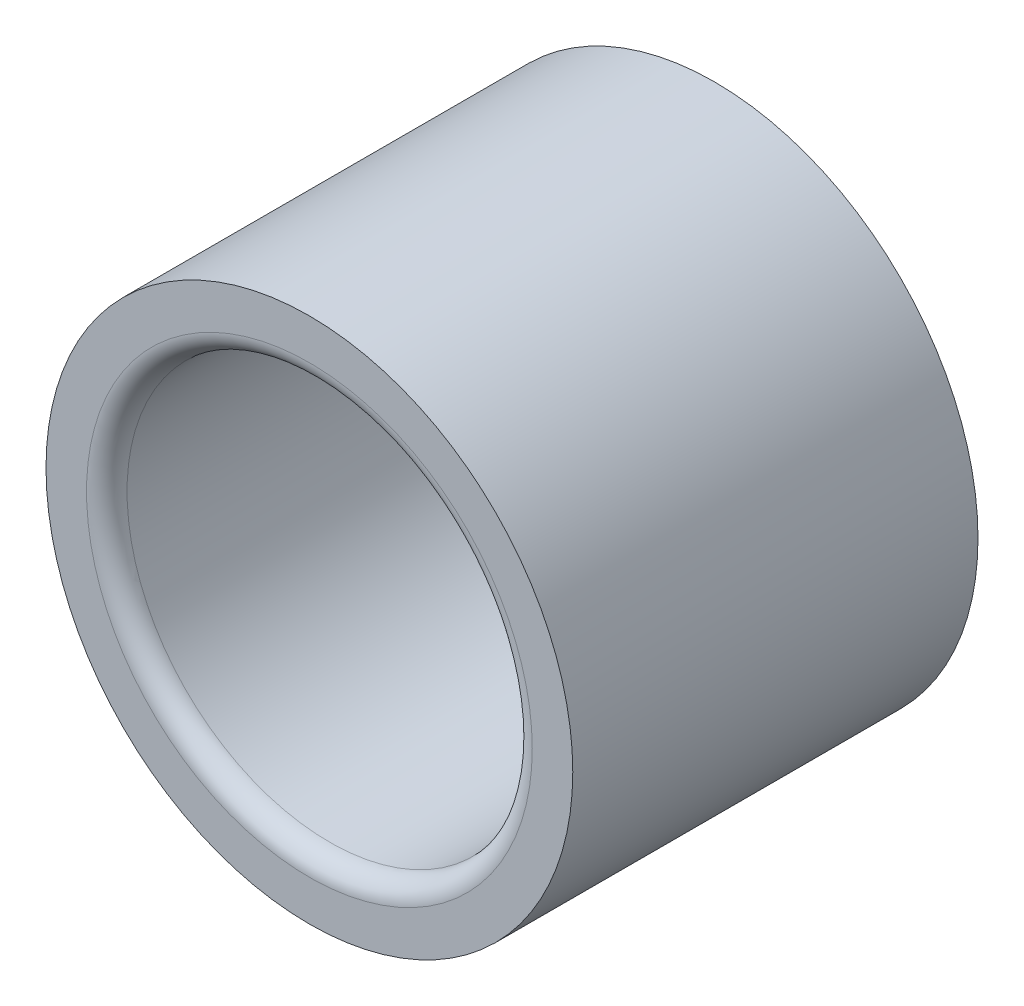
from build123d import *

# Parameters (mm, degrees)
SKETCH1_R           = 13
BOSS_EXTRUDE1_DEPTH = 20
SKETCH2_R           = 10
CUT_EXTRUDE1_DEPTH  = 17
FILLET3_R           = 1


with BuildPart() as part:
    # Sketch1 → Boss-Extrude1 (new body)
    with BuildSketch(Plane.XY):
        Circle(SKETCH1_R)
    extrude(amount=BOSS_EXTRUDE1_DEPTH)

    # Sketch2 → Cut-Extrude1 (cut)
    with BuildSketch(Plane.XY.offset(20)):
        Circle(SKETCH2_R)
    extrude(amount=-CUT_EXTRUDE1_DEPTH, mode=Mode.SUBTRACT)

    # Fillet3
    fillet3_edges = [part.edges().sort_by_distance(p)[0] for p in [
        (-10, 0, 20),
    ]]
    fillet(fillet3_edges, radius=FILLET3_R)


solid = part.part
